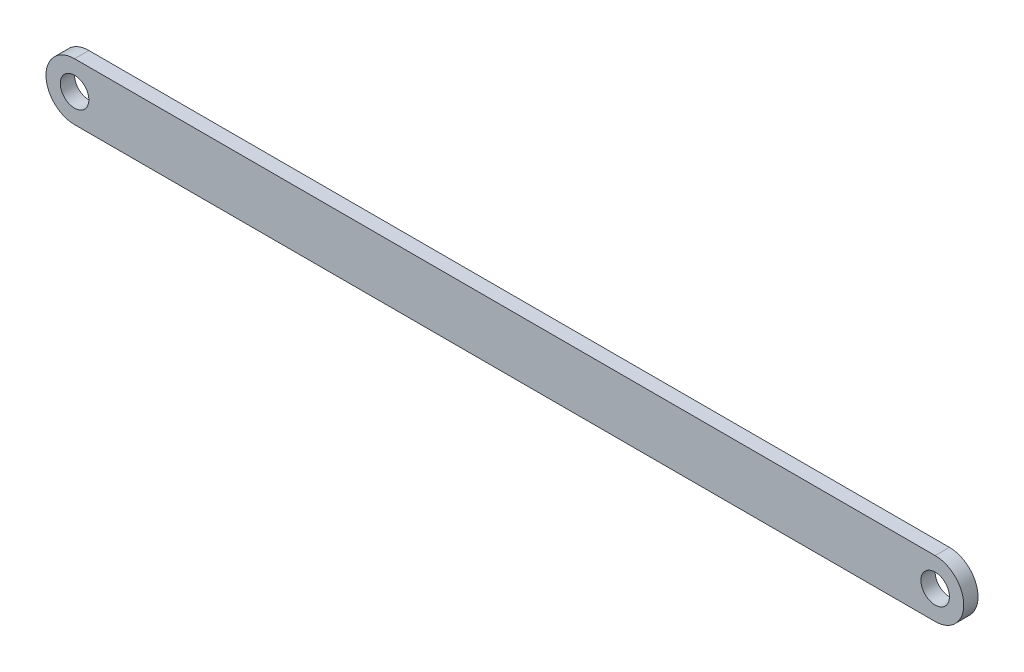
from build123d import *

# Parameters (mm, degrees)
ESBO_O1_R                = 1
RESSALTO_EXTRUS_O1_DEPTH = 1


with BuildPart() as part:
    # Esboço1 → Ressalto-extrusão1 (new body)
    with BuildSketch(Plane.XY):
        with BuildLine():
            Line((-30.13, 2), (30.13, 2))
            ThreePointArc((30.13, 2), (32.13, 0), (30.13, -2))
            Line((30.13, -2), (-30.13, -2))
            ThreePointArc((-30.13, -2), (-32.13, 0), (-30.13, 2))
        make_face()
        with Locations((-30.13, 0)):
            Circle(ESBO_O1_R, mode=Mode.SUBTRACT)
        with Locations((30.13, 0)):
            Circle(ESBO_O1_R, mode=Mode.SUBTRACT)
    extrude(amount=RESSALTO_EXTRUS_O1_DEPTH)


solid = part.part
